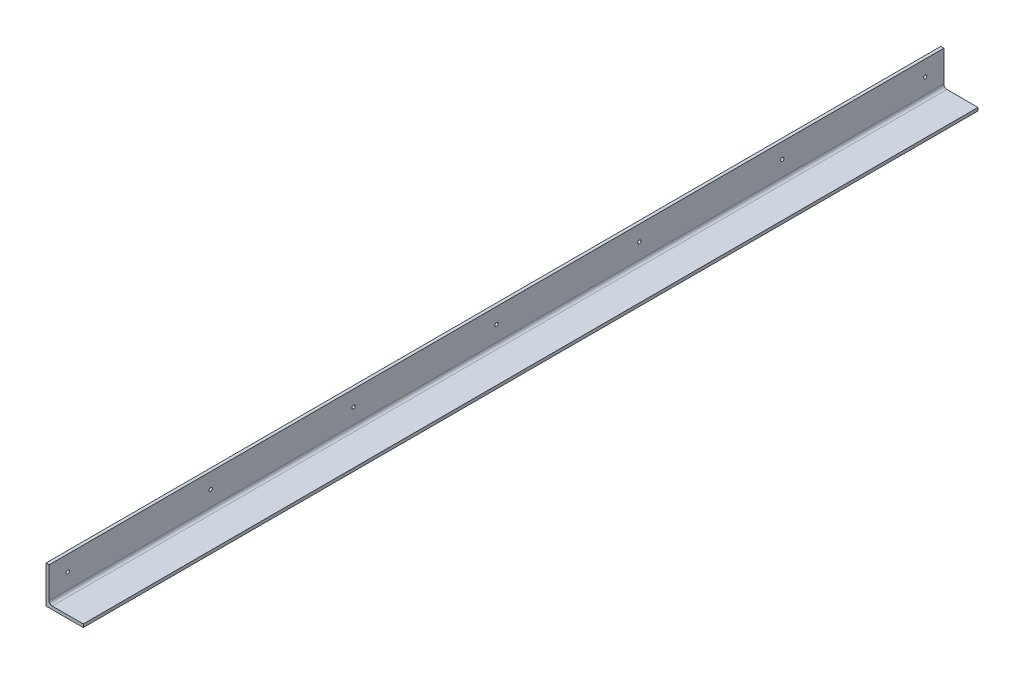
from build123d import *

# Parameters (mm, degrees)
BOSS_EXTRUDE1_DEPTH             = 1828.8
F_0_25_6_74688_DIAMETER_HOLE1_D = 6.74688


with BuildPart() as part:
    # Sketch1 → Boss-Extrude1 (new body)
    with BuildSketch(Plane.XY):
        with BuildLine():
            Line((0, 0), (0, 76.2))
            Line((0, 76.2), (6.35, 76.2))
            Line((6.35, 76.2), (6.35, 12.7))
            ThreePointArc((6.35, 12.7), (8.209871939, 8.209871939), (12.7, 6.35))
            Line((12.7, 6.35), (76.2, 6.35))
            Line((76.2, 6.35), (76.2, 0))
            Line((76.2, 0), (0, 0))
        make_face()
    extrude(amount=BOSS_EXTRUDE1_DEPTH)

    # Ø0.25 (6.74688) Diameter Hole1 (through all)
    with Locations(Plane(origin=(6.35, 0, 0), x_dir=(0, 0, -1), z_dir=(1, 0, 0))):
        with Locations((-1790.7, 44.45), (-1498.6, 44.45), (-1206.5, 44.45), (-914.4, 44.45), (-622.3, 44.45), (-330.2, 44.45), (-38.1, 44.45)):
            Hole(F_0_25_6_74688_DIAMETER_HOLE1_D / 2)


solid = part.part
